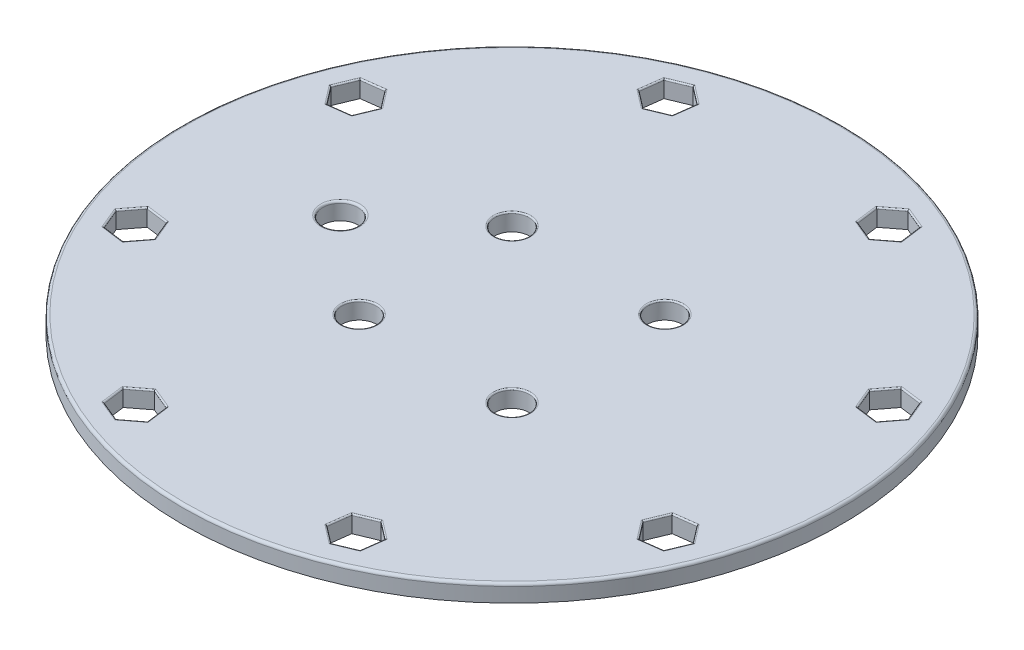
from build123d import *

# Parameters (mm, degrees)
SKETCH_1_W                  = 48
SKETCH_1_H                  = 6
CUT_EXTRUDE_1_DEPTH         = 2.5
CUT_EXTRUDE_2_DEPTH         = 2.5
CUT_EXTRUDE_3_DEPTH         = 2.5
CUT_EXTRUDE_4_DEPTH         = 2.5
CUT_EXTRUDE_5_DEPTH         = 2.5
CUT_EXTRUDE_6_DEPTH         = 2.5
CUT_EXTRUDE_7_DEPTH         = 2.5
CUT_EXTRUDE_8_DEPTH         = 2.5
HOLE_WIZARD_5_0_5_1_D       = 5
HOLE_WIZARD_3_0_3_1_D       = 3
HOLE_WIZARD_5_1_5_1_1_D     = 5.1
HOLE_WIZARD_5_1_5_1_1_DEPTH = 3.5
FILLET_1_R                  = 0.2
FILLET_2_R                  = 0.3
FILLET_3_R                  = 0.4
CUT_EXTRUDE_START           = -3.5
SKETCH_16_R                 = 48
CUT_EXTRUDE_9_DEPTH         = 3.5


with BuildPart() as part:
    # 草图1 → 旋转1 (revolve)
    with BuildSketch(Plane.XY, mode=Mode.PRIVATE) as revolve_1_sk:
        with Locations((24, 3)):
            Rectangle(SKETCH_1_W, SKETCH_1_H)
    revolve(revolve_1_sk.sketch.rotate(Axis((0, 6, 0), (0, -1, 0)), 270), axis=Axis((0, 6, 0), (0, -1, 0)))

    # 草图2 → 切除-拉伸1 (cut)
    with BuildSketch(Plane(origin=(0, 6, 0), x_dir=(-1, 0, 0), z_dir=(0, 1, 0))):
        Polygon((42.008441728, 15.650691899), (40.771164385, 18.637743641), (37.565663022, 19.059755901), (35.597439003, 16.49471642), (36.834716346, 13.507664678), (40.040217709, 13.085652417), align=None)
    extrude(amount=-CUT_EXTRUDE_1_DEPTH, mode=Mode.SUBTRACT)

    # 草图3 → 切除-拉伸2 (cut)
    with BuildSketch(Plane(origin=(0, 6, 0), x_dir=(-1, 0, 0), z_dir=(0, 1, 0))):
        Polygon((18.637743641, 40.771164385), (15.650691899, 42.008441728), (13.085652417, 40.040217709), (13.507664678, 36.834716346), (16.49471642, 35.597439003), (19.059755901, 37.565663022), align=None)
    extrude(amount=-CUT_EXTRUDE_2_DEPTH, mode=Mode.SUBTRACT)

    # 草图4 → 切除-拉伸3 (cut)
    with BuildSketch(Plane(origin=(0, 6, 0), x_dir=(-1, 0, 0), z_dir=(0, 1, 0))):
        Polygon((-15.650691899, 42.008441728), (-18.637743641, 40.771164385), (-19.059755901, 37.565663022), (-16.49471642, 35.597439003), (-13.507664678, 36.834716346), (-13.085652417, 40.040217709), align=None)
    extrude(amount=-CUT_EXTRUDE_3_DEPTH, mode=Mode.SUBTRACT)

    # 草图5 → 切除-拉伸4 (cut)
    with BuildSketch(Plane(origin=(0, 6, 0), x_dir=(-1, 0, 0), z_dir=(0, 1, 0))):
        Polygon((-40.771164385, 18.637743641), (-42.008441728, 15.650691899), (-40.040217709, 13.085652417), (-36.834716346, 13.507664678), (-35.597439003, 16.49471642), (-37.565663022, 19.059755901), align=None)
    extrude(amount=-CUT_EXTRUDE_4_DEPTH, mode=Mode.SUBTRACT)

    # 草图6 → 切除-拉伸5 (cut)
    with BuildSketch(Plane(origin=(0, 6, 0), x_dir=(-1, 0, 0), z_dir=(0, 1, 0))):
        Polygon((-42.008441728, -15.650691899), (-40.771164385, -18.637743641), (-37.565663022, -19.059755901), (-35.597439003, -16.49471642), (-36.834716346, -13.507664678), (-40.040217709, -13.085652417), align=None)
    extrude(amount=-CUT_EXTRUDE_5_DEPTH, mode=Mode.SUBTRACT)

    # 草图7 → 切除-拉伸6 (cut)
    with BuildSketch(Plane(origin=(0, 6, 0), x_dir=(-1, 0, 0), z_dir=(0, 1, 0))):
        Polygon((-18.637743641, -40.771164385), (-15.650691899, -42.008441728), (-13.085652417, -40.040217709), (-13.507664678, -36.834716346), (-16.49471642, -35.597439003), (-19.059755901, -37.565663022), align=None)
    extrude(amount=-CUT_EXTRUDE_6_DEPTH, mode=Mode.SUBTRACT)

    # 草图8 → 切除-拉伸7 (cut)
    with BuildSketch(Plane(origin=(0, 6, 0), x_dir=(-1, 0, 0), z_dir=(0, 1, 0))):
        Polygon((15.650691899, -42.008441728), (18.637743641, -40.771164385), (19.059755901, -37.565663022), (16.49471642, -35.597439003), (13.507664678, -36.834716346), (13.085652417, -40.040217709), align=None)
    extrude(amount=-CUT_EXTRUDE_7_DEPTH, mode=Mode.SUBTRACT)

    # 草图9 → 切除-拉伸8 (cut)
    with BuildSketch(Plane(origin=(0, 6, 0), x_dir=(-1, 0, 0), z_dir=(0, 1, 0))):
        Polygon((40.771164385, -18.637743641), (42.008441728, -15.650691899), (40.040217709, -13.085652417), (36.834716346, -13.507664678), (35.597439003, -16.49471642), (37.565663022, -19.059755901), align=None)
    extrude(amount=-CUT_EXTRUDE_8_DEPTH, mode=Mode.SUBTRACT)

    # Ø5.0 (5) 直径孔1 (through all)
    with Locations(Plane(origin=(0, 6, 0), x_dir=(1, 0, 0), z_dir=(0, 1, 0))):
        with Locations((11.136931804, 11.136931804), (11.136931804, -11.136931804), (-11.136931804, -11.136931804), (-11.136931804, 11.136931804)):
            Hole(HOLE_WIZARD_5_0_5_1_D / 2)

    # Ø3.0 (3) 直径孔1 (through all)
    with Locations(Plane(origin=(0, 3.5, 0), x_dir=(1, 0, 0), z_dir=(0, 1, 0))):
        with Locations((-38.802940365, -16.072704159), (-16.072704159, -38.802940365), (16.072704159, -38.802940365), (38.802940365, -16.072704159), (38.802940365, 16.072704159), (16.072704159, 38.802940365), (-16.072704159, 38.802940365), (-38.802940365, 16.072704159)):
            Hole(HOLE_WIZARD_3_0_3_1_D / 2)

    # Ø5.1 (5.1) 直径孔1
    with Locations(Plane(origin=(0, 6, 0), x_dir=(1, 0, 0), z_dir=(0, 1, 0))):
        with Locations((-25, 0)):
            Hole(HOLE_WIZARD_5_1_5_1_1_D / 2, depth=HOLE_WIZARD_5_1_5_1_1_DEPTH)

    # 圆角1
    fillet_1_edges = [part.edges().sort_by_distance(p)[0] for p in [
        (18.848749771, 6, -39.168413704),
        (17.14421777, 6, -41.389803057),
        (14.368172158, 6, -41.024329718),
        (13.296658547, 6, -38.437467027),
        (15.001190549, 6, -36.216077674),
        (17.777236161, 6, -36.581551013),
        (-14.368172158, 6, -41.024329718),
        (-17.14421777, 6, -41.389803057),
        (-18.848749771, 6, -39.168413704),
        (-17.777236161, 6, -36.581551013),
        (-15.001190549, 6, -36.216077674),
        (-13.296658547, 6, -38.437467027),
        (-41.024329718, 6, 14.368172158),
        (-41.389803057, 6, 17.14421777),
        (-39.168413704, 6, 18.848749771),
        (-36.581551013, 6, 17.777236161),
        (-39.168413704, 6, -18.848749771),
        (-41.389803057, 6, -17.14421777),
        (-41.024329718, 6, -14.368172158),
        (-38.437467027, 6, -13.296658547),
        (-36.216077674, 6, -15.001190549),
        (-36.216077674, 6, 15.001190549),
        (-36.581551013, 6, -17.777236161),
        (-38.437467027, 6, 13.296658547),
        (-8.636931804, 6, -11.136931804),
        (-8.636931804, 6, 11.136931804),
        (13.636931804, 6, 11.136931804),
        (13.636931804, 6, -11.136931804),
        (-37.302940365, 3.5, -16.072704159),
        (-14.572704159, 3.5, -38.802940365),
        (17.572704159, 3.5, -38.802940365),
        (40.302940365, 3.5, -16.072704159),
        (40.302940365, 3.5, 16.072704159),
        (17.572704159, 3.5, 38.802940365),
        (-14.572704159, 3.5, 38.802940365),
        (-37.302940365, 3.5, 16.072704159),
        (-18.848749771, 6, 39.168413704),
        (-17.14421777, 6, 41.389803057),
        (-14.368172158, 6, 41.024329718),
        (-13.296658547, 6, 38.437467027),
        (-15.001190549, 6, 36.216077674),
        (-17.777236161, 6, 36.581551013),
        (14.368172158, 6, 41.024329718),
        (17.14421777, 6, 41.389803057),
        (18.848749771, 6, 39.168413704),
        (17.777236161, 6, 36.581551013),
        (15.001190549, 6, 36.216077674),
        (13.296658547, 6, 38.437467027),
        (39.168413704, 6, 18.848749771),
        (41.389803057, 6, 17.14421777),
        (41.024329718, 6, 14.368172158),
        (38.437467027, 6, 13.296658547),
        (36.216077674, 6, 15.001190549),
        (36.581551013, 6, 17.777236161),
        (41.024329718, 6, -14.368172158),
        (41.389803057, 6, -17.14421777),
        (39.168413704, 6, -18.848749771),
        (36.581551013, 6, -17.777236161),
        (36.216077674, 6, -15.001190549),
        (38.437467027, 6, -13.296658547),
    ]]
    fillet(fillet_1_edges, radius=FILLET_1_R)

    # 圆角2
    fillet_2_edges = [part.edges().sort_by_distance(p)[0] for p in [
        (-22.45, 6, 0),
    ]]
    fillet(fillet_2_edges, radius=FILLET_2_R)

    # 圆角3
    fillet_3_edges = [part.edges().sort_by_distance(p)[0] for p in [
        (0, 6, 48),
    ]]
    fillet(fillet_3_edges, radius=FILLET_3_R)

    # 草图16 → 切除-拉伸9 (cut)
    with BuildSketch(Plane.XZ.offset(CUT_EXTRUDE_START)):
        with Locations(Location((0, 0, 0), (0, 0, 270))):
            Circle(SKETCH_16_R)
    extrude(amount=CUT_EXTRUDE_9_DEPTH, mode=Mode.SUBTRACT)


solid = part.part
